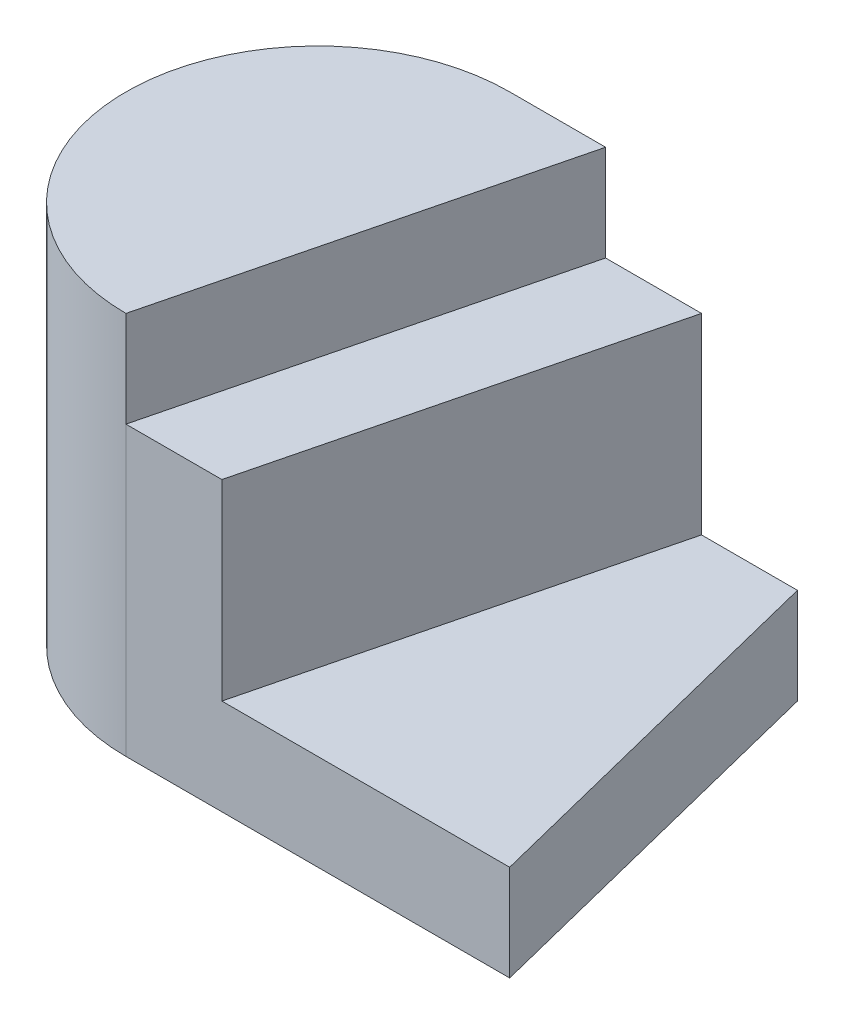
from build123d import *

# Parameters (mm, degrees)
BOSS_EXTRUDE1_DEPTH = 10
BOSS_EXTRUDE2_DEPTH = 20
BOSS_EXTRUDE3_DEPTH = 30


with BuildPart() as part:
    # Sketch1 → Boss-Extrude1 (new body)
    with BuildSketch(Plane(origin=(0, 0, 0), x_dir=(1, 0, 0), z_dir=(0, 1, 0))):
        with BuildLine():
            Line((0, 0), (-10, 40))
            Line((-10, 40), (-40, 40))
            ThreePointArc((-40, 40), (-60, 20), (-40, 0))
            Line((-40, 0), (0, 0))
        make_face()
    extrude(amount=BOSS_EXTRUDE1_DEPTH)

    # Sketch2 → Boss-Extrude2 (add)
    with BuildSketch(Plane(origin=(0, 10, 0), x_dir=(1, 0, 0), z_dir=(0, 1, 0))):
        Polygon((-30, 40), (-40, 0), (-30, 0), (-20, 40), align=None)
    extrude(amount=BOSS_EXTRUDE2_DEPTH)

    # Sketch3 → Boss-Extrude3 (add)
    with BuildSketch(Plane(origin=(0, 10, 0), x_dir=(1, 0, 0), z_dir=(0, 1, 0))):
        with BuildLine():
            Line((-30, 40), (-40, 0))
            ThreePointArc((-40, 0), (-60, 20), (-40, 40))
            Line((-40, 40), (-30, 40))
        make_face()
    extrude(amount=BOSS_EXTRUDE3_DEPTH)


solid = part.part
